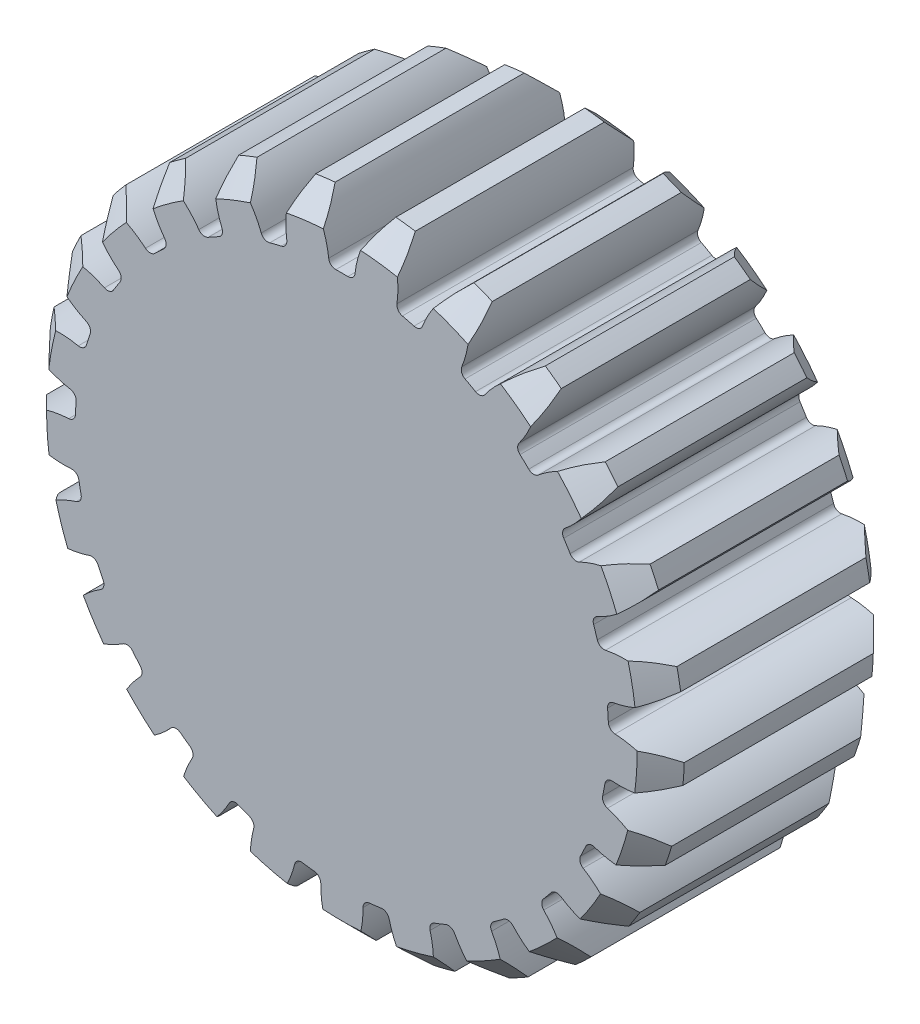
from build123d import *

# Parameters (mm, degrees)
SKETCH2_R                = 27
BOSS_EXTRUDE1_DEPTH      = 10
CUT_EXTRUDE1_DEPTH       = 40.471508712
FILLET1_R                = 0.6
CHAMFER1_SIZE            = 2
CIRPATTERN2_COUNT        = 25
FILLET1_OF_CIRPATTERN2_R = 0.6


with BuildPart() as part:
    # Sketch2 → Boss-Extrude1 (new, symmetric)
    with BuildSketch(Plane.XY):
        Circle(SKETCH2_R)
    extrude(amount=BOSS_EXTRUDE1_DEPTH, both=True)

    # Sketch3 → Cut-Extrude1 (cut, symmetric)
    with BuildSketch(Plane.XY):
        with BuildLine():
            ThreePointArc((-2.569085244, 26.877496182), (-1.510220721, 24.781486697), (-1.072022538, 22.474446994))
            ThreePointArc((-1.072022538, 22.474446994), (0, 22.5), (1.072022538, 22.474446994))
            ThreePointArc((1.072022538, 22.474446994), (1.510220721, 24.781486697), (2.569085244, 26.877496182))
            ThreePointArc((2.569085244, 26.877496182), (0, 27), (-2.569085244, 26.877496182))
        make_face()
    cut_extrude1 = extrude(amount=CUT_EXTRUDE1_DEPTH, both=True, mode=Mode.SUBTRACT)

    # Fillet1
    fillet1_edges = [part.edges().sort_by_distance(p)[0] for p in [
        (1.072022538, 22.474446994, 0),
        (-1.072022538, 22.474446994, 0),
    ]]
    fillet(fillet1_edges, radius=FILLET1_R)

    # Chamfer1
    chamfer1_edges = [part.edges().sort_by_distance(p)[0] for p in [
        (0, -27, -10),
        (0, -27, 10),
    ]]
    chamfer(chamfer1_edges, length=CHAMFER1_SIZE)

    # CirPattern2: Cut-Extrude1 ×25 about axis
    cirpattern2_axis = Axis((0, -0.074967836, 0), (0, 0, 1))
    for i in range(1, CIRPATTERN2_COUNT):
        add(cut_extrude1.rotate(cirpattern2_axis, i * 360 / CIRPATTERN2_COUNT), mode=Mode.SUBTRACT)

    # Fillet1 of CirPattern2
    fillet1_of_cirpattern2_edges = [part.edges().sort_by_distance(p)[0] for p in [
        (-4.569468451, 22.032616825, 0),
        (-6.646154408, 21.499414497, 0),
        (-9.923842932, 20.201685807, 0),
        (-11.802683954, 19.168784214, 0),
        (-14.654665864, 17.096698067, 0),
        (-16.21760746, 15.628998216, 0),
        (-18.464682244, 12.912751406, 0),
        (-19.613519045, 11.102474275, 0),
        (-21.11449473, 7.91273858, 0),
        (-21.777041095, 5.873630539, 0),
        (-22.437605858, 2.410828783, 0),
        (-22.572231563, 0.27101449, 0),
        (-22.350879691, -3.247272758, 0),
        (-21.949125706, -5.353340901, 0),
        (-20.859765552, -8.706046714, 0),
        (-19.946875559, -10.646036701, 0),
        (-18.057955626, -13.622498241, 0),
        (-16.69128986, -15.274513365, 0),
        (-14.121497936, -17.687708609, 0),
        (-12.386929033, -18.947946684, 0),
        (-9.297734596, -20.646245698, 0),
        (-7.304251899, -21.435521333, 0),
        (-3.889760396, -22.312213744, 0),
        (-1.762621756, -22.580933846, 0),
        (1.762621756, -22.580933846, 0),
        (3.889760396, -22.312213744, 0),
        (7.304251899, -21.435521333, 0),
        (9.297734596, -20.646245698, 0),
        (12.386929033, -18.947946684, 0),
        (14.121497936, -17.687708609, 0),
        (16.69128986, -15.274513365, 0),
        (18.057955626, -13.622498241, 0),
        (19.946875559, -10.646036701, 0),
        (20.859765552, -8.706046714, 0),
        (21.949125706, -5.353340901, 0),
        (22.350879691, -3.247272758, 0),
        (22.572231563, 0.27101449, 0),
        (22.437605858, 2.410828783, 0),
        (21.777041095, 5.873630539, 0),
        (21.11449473, 7.91273858, 0),
        (19.613519045, 11.102474275, 0),
        (18.464682244, 12.912751406, 0),
        (16.21760746, 15.628998216, 0),
        (14.654665864, 17.096698067, 0),
        (11.802683954, 19.168784214, 0),
        (9.923842932, 20.201685807, 0),
        (6.646154408, 21.499414497, 0),
        (4.569468451, 22.032616825, 0),
    ]]
    fillet(fillet1_of_cirpattern2_edges, radius=FILLET1_OF_CIRPATTERN2_R)


solid = part.part
